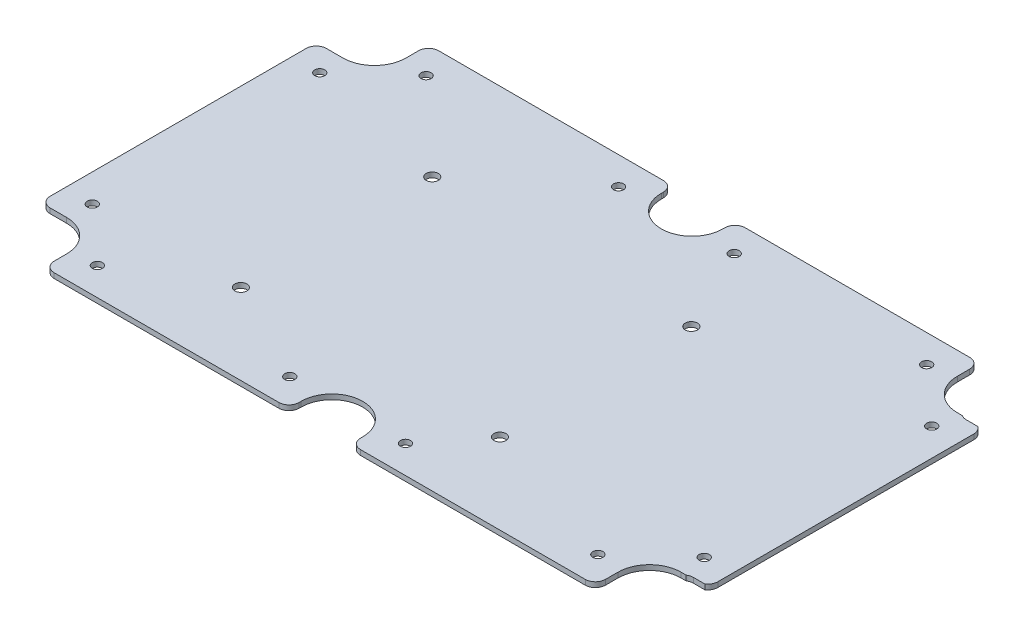
from build123d import *

# Parameters (mm, degrees)
SKETCH1_R           = 1.5875
BOSS_EXTRUDE1_DEPTH = 1.5875
CUT_EXTRUDE1_DEPTH  = 10


with BuildPart() as part:
    # Sketch1 → Boss-Extrude1 (new body)
    with BuildSketch(Plane.XZ.offset(-9.652)):
        with BuildLine():
            Line((-9.649529152, -57.088970848), (-9.649529152, -56.4515))
            ThreePointArc((-9.649529152, -56.4515), (0, -46.801970848), (9.649529152, -56.4515))
            Line((9.649529152, -56.4515), (9.649529152, -57.088970848))
            ThreePointArc((9.649529152, -57.088970848), (10.579465122, -59.334034878), (12.824529152, -60.263970848))
            Line((12.824529152, -60.263970848), (83.228304068, -60.263970848))
            ThreePointArc((83.228304068, -60.263970848), (85.473368098, -59.334034878), (86.403304068, -57.088970848))
            Line((86.403304068, -57.088970848), (86.403304068, -53.197827078))
            ThreePointArc((86.403304068, -53.197827078), (89.303980599, -46.194974456), (96.306833221, -43.294297925))
            Line((96.306833221, -43.294297925), (97.90475189, -43.294297925))
            ThreePointArc((97.90475189, -43.294297925), (98.735652203, -42.90897515), (99.641972868, -42.776869801))
            Line((99.641972868, -42.776869801), (103.212691826, -42.776869801))
            ThreePointArc((103.212691826, -42.776869801), (104.267987777, -41.630083879), (104.650470848, -40.119297925))
            Line((104.650470848, -40.119297925), (104.650470848, 40.119297925))
            ThreePointArc((104.650470848, 40.119297925), (104.267987777, 41.630083879), (103.212691826, 42.776869801))
            Line((103.212691826, 42.776869801), (99.641972868, 42.776869801))
            ThreePointArc((99.641972868, 42.776869801), (98.735652203, 42.90897515), (97.90475189, 43.294297925))
            Line((97.90475189, 43.294297925), (96.306833221, 43.294297925))
            ThreePointArc((96.306833221, 43.294297925), (89.303980599, 46.194974456), (86.403304068, 53.197827078))
            Line((86.403304068, 53.197827078), (86.403304068, 57.088970848))
            ThreePointArc((86.403304068, 57.088970848), (85.473368098, 59.334034878), (83.228304068, 60.263970848))
            Line((83.228304068, 60.263970848), (12.824529152, 60.263970848))
            ThreePointArc((12.824529152, 60.263970848), (10.579465122, 59.334034878), (9.649529152, 57.088970848))
            Line((9.649529152, 57.088970848), (9.649529152, 56.4515))
            ThreePointArc((9.649529152, 56.4515), (0, 46.801970848), (-9.649529152, 56.4515))
            Line((-9.649529152, 56.4515), (-9.649529152, 57.088970848))
            ThreePointArc((-9.649529152, 57.088970848), (-10.579465122, 59.334034878), (-12.824529152, 60.263970848))
            Line((-12.824529152, 60.263970848), (-83.228304068, 60.263970848))
            ThreePointArc((-83.228304068, 60.263970848), (-85.473368098, 59.334034878), (-86.403304068, 57.088970848))
            Line((-86.403304068, 57.088970848), (-86.403304068, 53.197827078))
            ThreePointArc((-86.403304068, 53.197827078), (-89.303980599, 46.194974456), (-96.306833221, 43.294297925))
            Line((-96.306833221, 43.294297925), (-101.475470848, 43.294297925))
            ThreePointArc((-101.475470848, 43.294297925), (-103.720534878, 42.364361955), (-104.650470848, 40.119297925))
            Line((-104.650470848, 40.119297925), (-104.650470848, -40.119297925))
            ThreePointArc((-104.650470848, -40.119297925), (-103.720534878, -42.364361955), (-101.475470848, -43.294297925))
            Line((-101.475470848, -43.294297925), (-96.306833221, -43.294297925))
            ThreePointArc((-96.306833221, -43.294297925), (-89.303980599, -46.194974456), (-86.403304068, -53.197827078))
            Line((-86.403304068, -53.197827078), (-86.403304068, -57.088970848))
            ThreePointArc((-86.403304068, -57.088970848), (-85.473368098, -59.334034878), (-83.228304068, -60.263970848))
            Line((-83.228304068, -60.263970848), (-12.824529152, -60.263970848))
            ThreePointArc((-12.824529152, -60.263970848), (-10.579465122, -59.334034878), (-9.649529152, -57.088970848))
        make_face()
        with Locations(Location((18.12925, 51.53025, 0), (0, 0, 90))):
            Circle(SKETCH1_R, mode=Mode.SUBTRACT)
        with Locations(Location((18.12925, -51.53025, 0), (0, 0, 90))):
            Circle(SKETCH1_R, mode=Mode.SUBTRACT)
        with Locations(Location((95.91675, -35.65525, 0), (0, 0, 90))):
            Circle(SKETCH1_R, mode=Mode.SUBTRACT)
        with Locations(Location((78.45425, 51.53025, 0), (0, 0, 90))):
            Circle(SKETCH1_R, mode=Mode.SUBTRACT)
        with Locations(Location((-95.91675, 35.65525, 0), (0, 0, 90))):
            Circle(SKETCH1_R, mode=Mode.SUBTRACT)
        with Locations(Location((-78.45425, -51.53025, 0), (0, 0, 90))):
            Circle(SKETCH1_R, mode=Mode.SUBTRACT)
        with Locations(Location((-18.12925, -51.53025, 0), (0, 0, 90))):
            Circle(SKETCH1_R, mode=Mode.SUBTRACT)
        with Locations(Location((-95.91675, -35.65525, 0), (0, 0, 90))):
            Circle(SKETCH1_R, mode=Mode.SUBTRACT)
        with Locations(Location((-78.45425, 51.53025, 0), (0, 0, 90))):
            Circle(SKETCH1_R, mode=Mode.SUBTRACT)
        with Locations(Location((95.91675, 35.65525, 0), (0, 0, 90))):
            Circle(SKETCH1_R, mode=Mode.SUBTRACT)
        with Locations(Location((78.45425, -51.53025, 0), (0, 0, 90))):
            Circle(SKETCH1_R, mode=Mode.SUBTRACT)
        with Locations(Location((-18.12925, 51.53025, 0), (0, 0, 90))):
            Circle(SKETCH1_R, mode=Mode.SUBTRACT)
    extrude(amount=-BOSS_EXTRUDE1_DEPTH)

    # Sketch2 → Cut-Extrude1 (cut)
    with BuildSketch(Plane(origin=(0, 11.2395, 0), x_dir=(1, 0, 0), z_dir=(0, 1, 0))):
        with BuildLine():
            ThreePointArc((-48.1, 25), (-51.343502884, 26.343502884), (-50, 23.1))
            Line((-50, 23.1), (-50, 25))
            Line((-50, 25), (-48.1, 25))
        make_face()
        with BuildLine():
            Line((-50, 25), (-50, 23.1))
            ThreePointArc((-50, 23.1), (-48.656497116, 23.656497116), (-48.1, 25))
            Line((-48.1, 25), (-50, 25))
        make_face()
        with BuildLine():
            Line((-48.1, -35), (-50, -35))
            Line((-50, -35), (-50, -33.1))
            ThreePointArc((-50, -33.1), (-51.343502884, -36.343502884), (-48.1, -35))
        make_face()
        with BuildLine():
            Line((-50, -33.1), (-50, -35))
            Line((-50, -35), (-48.1, -35))
            ThreePointArc((-48.1, -35), (-48.656497116, -33.656497116), (-50, -33.1))
        make_face()
        with BuildLine():
            ThreePointArc((31.21, -33.1), (29.866497116, -33.656497116), (29.31, -35))
            Line((29.31, -35), (31.21, -35))
            Line((31.21, -35), (31.21, -33.1))
        make_face()
        with BuildLine():
            Line((31.21, -35), (29.31, -35))
            ThreePointArc((29.31, -35), (31.21, -36.9), (33.11, -35))
            ThreePointArc((33.11, -35), (32.553502884, -33.656497116), (31.21, -33.1))
            Line((31.21, -33.1), (31.21, -35))
        make_face()
        with BuildLine():
            ThreePointArc((33.11, 25), (31.21, 26.9), (29.31, 25))
            Line((29.31, 25), (31.21, 25))
            Line((31.21, 25), (31.21, 23.1))
            ThreePointArc((31.21, 23.1), (32.553502884, 23.656497116), (33.11, 25))
        make_face()
        with BuildLine():
            Line((31.21, 25), (29.31, 25))
            ThreePointArc((29.31, 25), (29.866497116, 23.656497116), (31.21, 23.1))
            Line((31.21, 23.1), (31.21, 25))
        make_face()
    extrude(amount=-CUT_EXTRUDE1_DEPTH, mode=Mode.SUBTRACT)


solid = part.part
